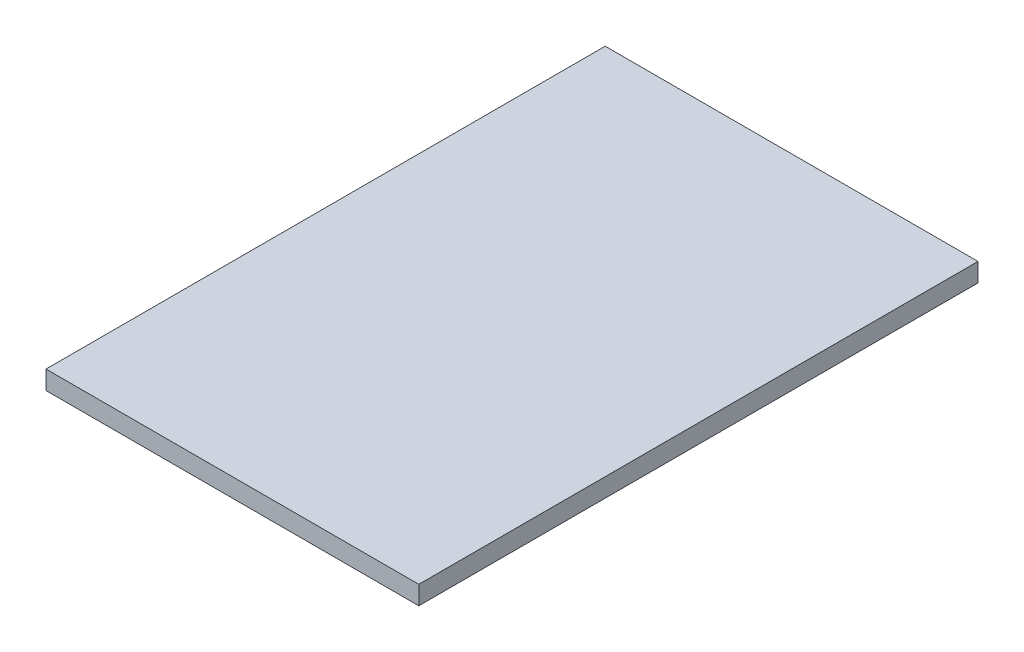
from build123d import *

# Parameters (mm, degrees)
SZKIC1_W                    = 200
SZKIC1_H                    = 300
DODANIE_WYCI_GNI_CIE1_DEPTH = 10


with BuildPart() as part:
    # Szkic1 → Dodanie-wyciągnięcie1 (new body)
    with BuildSketch(Plane(origin=(0, 0, 0), x_dir=(1, 0, 0), z_dir=(0, 1, 0))):
        Rectangle(SZKIC1_W, SZKIC1_H)
    extrude(amount=DODANIE_WYCI_GNI_CIE1_DEPTH)


solid = part.part
